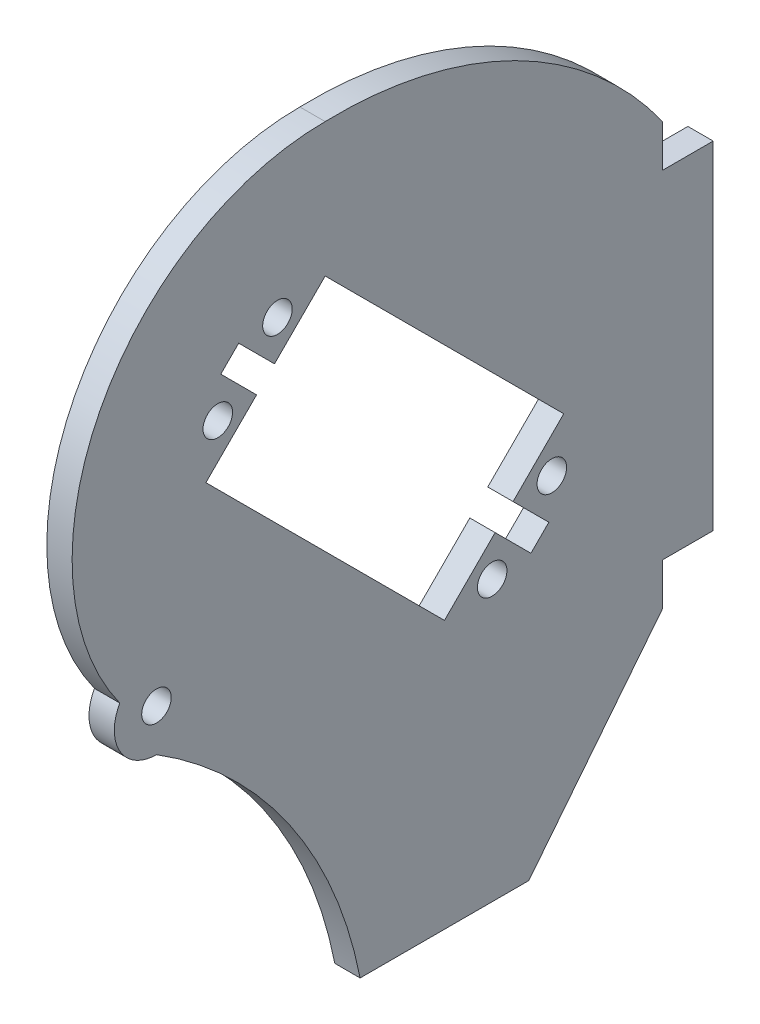
from build123d import *

# Parameters (mm, degrees)
CROQUIS1_R              = 1.75
SALIENTE_EXTRUIR1_DEPTH = 3


with BuildPart() as part:
    # Croquis1 → Saliente-Extruir1 (new body)
    with BuildSketch(Plane(origin=(0, 0, 0), x_dir=(0, 0, -1), z_dir=(1, 0, 0))):
        with BuildLine():
            Line((4.142135624, -60), (24.142135624, -60))
            Line((24.142135624, -60), (40, -40))
            Line((40, -40), (40, -35))
            Line((40, -35), (46, -35))
            Line((46, -35), (46, 5))
            Line((46, 5), (40, 5))
            Line((40, 5), (40, 10))
            ThreePointArc((40, 10), (22.503199777, 25.006399554), (0, 30))
            ThreePointArc((0, 30), (-26.700709952, 13.677429877), (-24.346472536, -17.528527464))
            ThreePointArc((-24.346472536, -17.528527464), (-24.321884003, -22.514223272), (-20, -25))
            ThreePointArc((-20, -25), (-4.291896326, -39.991262484), (4.142135624, -60))
        make_face()
        with Locations((-12.730077402, 5.654698909)):
            Circle(CROQUIS1_R, mode=Mode.SUBTRACT)
        with Locations((-5.658477353, 12.726298958)):
            Circle(CROQUIS1_R, mode=Mode.SUBTRACT)
        with Locations((26.870057685, -19.798989873)):
            Circle(CROQUIS1_R, mode=Mode.SUBTRACT)
        with Locations((19.797157185, -26.871890373)):
            Circle(CROQUIS1_R, mode=Mode.SUBTRACT)
        with Locations((-20, -20)):
            Circle(CROQUIS1_R, mode=Mode.SUBTRACT)
        Polygon((-14.142135624, 0), (14.142135624, -28.284271247), (20.150710576, -22.275696296), (24.393351263, -26.518336983), (26.516504294, -24.395183951), (22.273863607, -20.152543264), (28.284271247, -14.142135624), (0, 14.142135624), (-6.01040764, 8.131727984), (-10.253048327, 12.374368671), (-12.374368671, 10.253048327), (-8.131727984, 6.01040764), align=None, mode=Mode.SUBTRACT)
    extrude(amount=SALIENTE_EXTRUIR1_DEPTH)


solid = part.part
